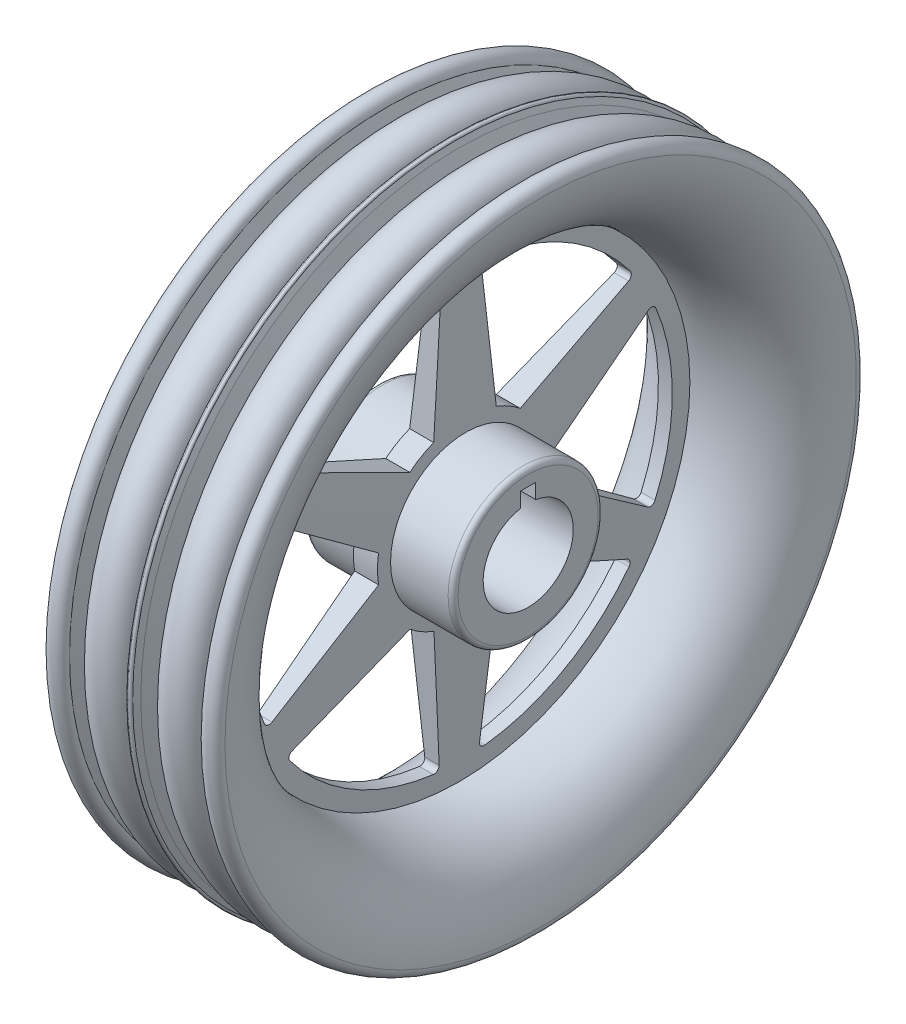
from build123d import *

# Parameters (mm, degrees)
CUT_EXTRUDE1_DEPTH      = 195.997028149
CUT_EXTRUDE1_DEPTH_BACK = 195.997028149
CUT_EXTRUDE2_DEPTH      = 195.997028149
CUT_EXTRUDE2_DEPTH_BACK = 195.997028149
SKETCH1_3_R             = 9.027514405


with BuildPart() as part:
    # Sketch1 → Revolve3 (revolve)
    with BuildSketch(Plane(origin=(0, 0, 0), x_dir=(1, 0, 0), z_dir=(0, 1, 0))):
        with BuildLine():
            Line((-30, 28), (-30, 18))
            Line((-30, 18), (30, 18))
            Line((30, 18), (30, 28))
            ThreePointArc((30, 28), (29.414213562, 29.414213562), (28, 30))
            Line((28, 30), (5, 30))
            Line((5, 30), (2.469421691, 92.117420672))
            ThreePointArc((2.469421691, 92.117420672), (25.300933435, 102.846260938), (34.988642439, 126.138625272))
            ThreePointArc((34.988642439, 126.138625272), (31.060886789, 130), (27.000665154, 126.27816181))
            Line((27.000665154, 126.27816181), (18.809538908, 106.503033735))
            ThreePointArc((18.809538908, 106.503033735), (15.652351884, 102.450798498), (11.101656009, 104.833991184))
            Line((11.101656009, 104.833991184), (2.005965456, 126.792930676))
            Line((2.005965456, 126.792930676), (0.985691266, 129.016882572))
            ThreePointArc((0.985691266, 129.016882572), (0.693918588, 129.697020664), (0, 129.954306716))
            ThreePointArc((0, 129.954306716), (-0.703580865, 129.672125741), (-1.084774418, 129.016882572))
            Line((-1.084774418, 129.016882572), (-11.101656009, 104.833991184))
            ThreePointArc((-11.101656009, 104.833991184), (-15.402356457, 103.666119262), (-18.819401768, 106.526844785))
            Line((-18.819401768, 106.526844785), (-27.000665154, 126.27816181))
            ThreePointArc((-27.000665154, 126.27816181), (-31.060886789, 130), (-34.988642439, 126.138625272))
            ThreePointArc((-34.988642439, 126.138625272), (-25.310755013, 102.85654033), (-2.497784447, 92.119438382))
            Line((-2.497784447, 92.119438382), (-5, 30))
            Line((-5, 30), (-28, 30))
            ThreePointArc((-28, 30), (-29.414213562, 29.414213562), (-30, 28))
        make_face()
    revolve(axis=Axis((-45.077319588, 0, 0), (1, 0, 0)))

    # Sketch2 → Cut-Extrude1 (cut, two sides: drawn at the far end of the back side and taken through both)
    with BuildSketch(Plane.ZY.offset(30).offset(-CUT_EXTRUDE1_DEPTH_BACK)):
        with BuildLine():
            Line((74.908431627, 34.368065818), (34.571216938, 5.461772553))
            ThreePointArc((34.571216938, 5.461772553), (34.999949427, -0.05949865), (34.552447547, -5.579280285))
            Line((34.552447547, -5.579280285), (75.235511653, -33.684580582))
            ThreePointArc((75.235511653, -33.684580582), (76.933681938, -33.958657623), (78.216578934, -32.812762412))
            ThreePointArc((78.216578934, -32.812762412), (84.819558244, 0.39132677), (77.910483226, 33.53307622))
            ThreePointArc((77.910483226, 33.53307622), (76.609350121, 34.669248455), (74.908431627, 34.368065818))
        make_face()
        with BuildLine():
            Line((22.108022236, 27.133657196), (66.789458327, 48.313574068))
            ThreePointArc((66.789458327, 48.313574068), (67.875901149, 49.647194153), (67.524975284, 51.331163148))
            ThreePointArc((67.524975284, 51.331163148), (42.070880198, 73.651555562), (9.91474574, 84.238995805))
            ThreePointArc((9.91474574, 84.238995805), (8.280225168, 83.6802676), (7.690597736, 82.056637655))
            Line((7.690597736, 82.056637655), (12.555574688, 32.670438385))
            ThreePointArc((12.555574688, 32.670438385), (17.551502056, 30.28109601), (22.108022236, 27.133657196))
        make_face()
        with BuildLine():
            Line((67.21783389, -47.688571838), (22.01564225, -27.208665832))
            ThreePointArc((22.01564225, -27.208665832), (17.448447372, -30.34059466), (12.444425312, -32.712937481))
            Line((12.444425312, -32.712937481), (8.446053327, -81.99815465))
            ThreePointArc((8.446053327, -81.99815465), (9.057780789, -83.605851776), (10.69160365, -84.14392556))
            ThreePointArc((10.69160365, -84.14392556), (42.748678046, -73.260228792), (67.995737486, -50.705919585))
            ThreePointArc((67.995737486, -50.705919585), (68.329124953, -49.011019145), (67.21783389, -47.688571838))
        make_face()
        with BuildLine():
            Line((-7.690597736, -82.056637655), (-12.555574688, -32.670438385))
            ThreePointArc((-12.555574688, -32.670438385), (-17.551502056, -30.28109601), (-22.108022236, -27.133657196))
            Line((-22.108022236, -27.133657196), (-66.789458327, -48.313574068))
            ThreePointArc((-66.789458327, -48.313574068), (-67.875901149, -49.647194153), (-67.524975284, -51.331163148))
            ThreePointArc((-67.524975284, -51.331163148), (-42.070880198, -73.651555562), (-9.91474574, -84.238995805))
            ThreePointArc((-9.91474574, -84.238995805), (-8.280225168, -83.6802676), (-7.690597736, -82.056637655))
        make_face()
        with BuildLine():
            Line((-12.444425312, 32.712937481), (-8.446053327, 81.99815465))
            ThreePointArc((-8.446053327, 81.99815465), (-9.057780789, 83.605851776), (-10.69160365, 84.14392556))
            ThreePointArc((-10.69160365, 84.14392556), (-42.748678046, 73.260228792), (-67.995737486, 50.705919585))
            ThreePointArc((-67.995737486, 50.705919585), (-68.329124953, 49.011019145), (-67.21783389, 47.688571838))
            Line((-67.21783389, 47.688571838), (-22.01564225, 27.208665832))
            ThreePointArc((-22.01564225, 27.208665832), (-17.448447372, 30.34059466), (-12.444425312, 32.712937481))
        make_face()
        with BuildLine():
            Line((-74.908431627, -34.368065818), (-34.571216938, -5.461772553))
            ThreePointArc((-34.571216938, -5.461772553), (-34.999949427, 0.05949865), (-34.552447547, 5.579280285))
            Line((-34.552447547, 5.579280285), (-75.235511653, 33.684580582))
            ThreePointArc((-75.235511653, 33.684580582), (-76.933681938, 33.958657623), (-78.216578934, 32.812762412))
            ThreePointArc((-78.216578934, 32.812762412), (-84.819558244, -0.39132677), (-77.910483226, -33.53307622))
            ThreePointArc((-77.910483226, -33.53307622), (-76.609350121, -34.669248455), (-74.908431627, -34.368065818))
        make_face()
    extrude(amount=CUT_EXTRUDE1_DEPTH + CUT_EXTRUDE1_DEPTH_BACK, mode=Mode.SUBTRACT)

    # Sketch3 → Cut-Extrude2 (cut, two sides: drawn at the far end of the back side and taken through both)
    with BuildSketch(Plane(origin=(30, 0, 0), x_dir=(0, 0, -1), z_dir=(1, 0, 0)).offset(-CUT_EXTRUDE2_DEPTH_BACK)):
        with BuildLine():
            Line((3, 17.748239349), (3, 23.748239349))
            Line((3, 23.748239349), (-3, 23.748239349))
            Line((-3, 23.748239349), (-3, 17.748239349))
            ThreePointArc((-3, 17.748239349), (0, -18), (3, 17.748239349))
        make_face()
    extrude(amount=CUT_EXTRUDE2_DEPTH + CUT_EXTRUDE2_DEPTH_BACK, mode=Mode.SUBTRACT)


with BuildPart() as body_2:
    # Sketch1<3> → Revolve4 (revolve)
    with BuildSketch(Plane(origin=(0, 0, 0), x_dir=(1, 0, 0), z_dir=(0, 1, 0))):
        with Locations((-14.609927428, 119.954306716)):
            Circle(SKETCH1_3_R)
        with Locations((14.609927428, 119.954306716)):
            Circle(SKETCH1_3_R)
    revolve(axis=Axis((-45.077319588, 0, 0), (1, 0, 0)))


solid = Compound([part.part, body_2.part])
